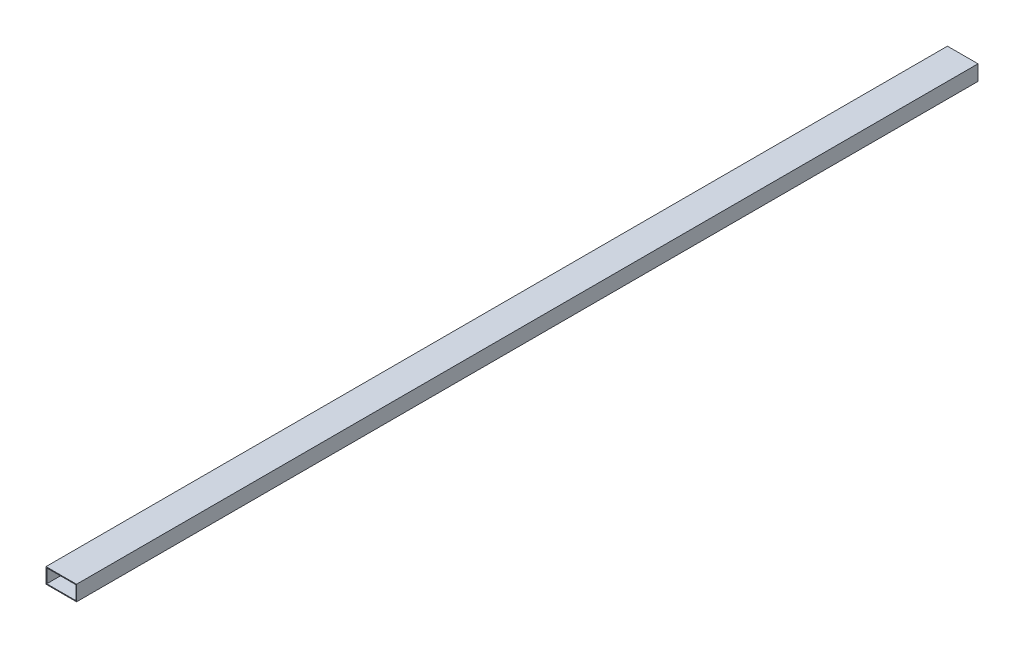
from build123d import *

# Parameters (mm, degrees)
SKETCH_1_W      = 40
SKETCH_1_H      = 20
SKETCH_1_W_2    = 38
SKETCH_1_H_2    = 18
EXTRUDE_1_DEPTH = 1180


with BuildPart() as part:
    # 草图1 → 凸台-拉伸1 (new body)
    with BuildSketch(Plane.XY):
        with Locations((20, 10)):
            Rectangle(SKETCH_1_W, SKETCH_1_H)
        with Locations((20, 10)):
            Rectangle(SKETCH_1_W_2, SKETCH_1_H_2, mode=Mode.SUBTRACT)
    extrude(amount=EXTRUDE_1_DEPTH)


solid = part.part
